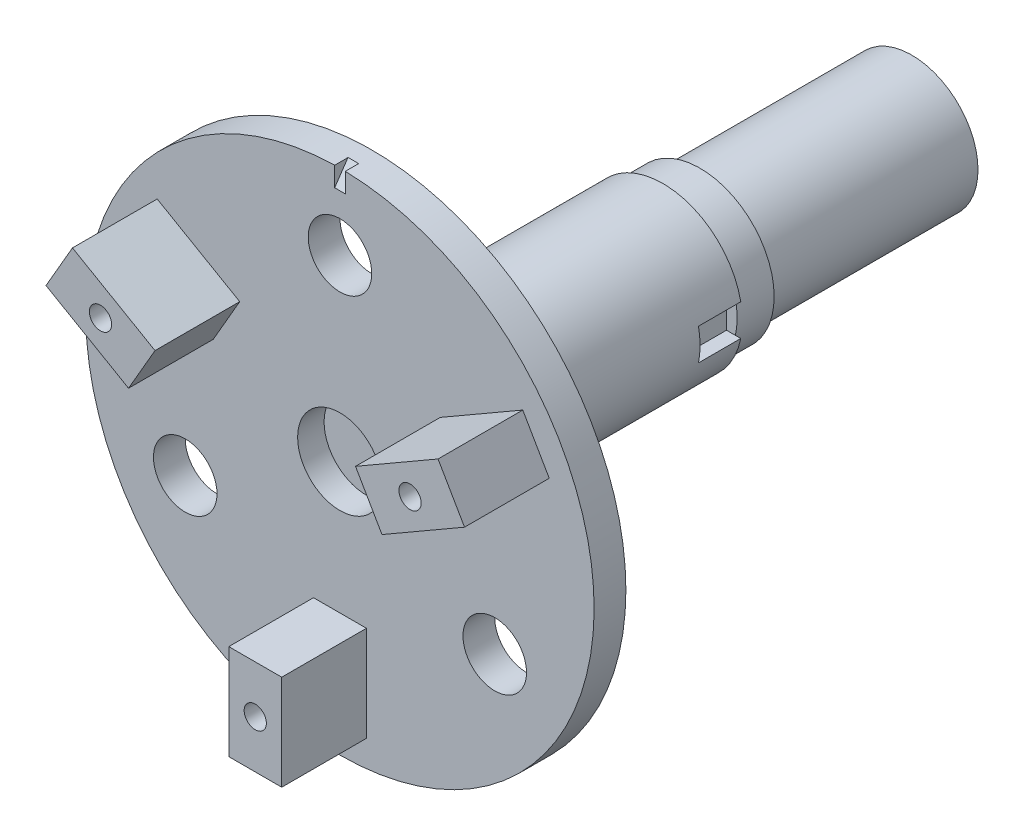
from build123d import *

# Parameters (mm, degrees)
SKETCH1_R                        = 48
SKETCH1_R_2                      = 8
EX_CARRIER_FRONT_PLATE_4MM_DEPTH = 3
SKETCH2_R                        = 6
CUT_PIN_HOLE_12_DEPTH            = 69.14690015
PAT_PIN_HOLES_3X120_COUNT        = 3
CUT_EXTRUDE1_DEPTH               = 1
SKETCH4_W                        = 10
SKETCH4_H                        = 18
BOSS_EXTRUDE1_DEPTH              = 19
SKETCH5_R                        = 2.1
CUT_EXTRUDE3_DEPTH               = 12
CIRPATTERN1_COUNT                = 3
CIRPATTERN2_COUNT                = 3
SKETCH7_W                        = 4.5
SKETCH7_H                        = 8
CUT_MB6_TAB_GROOVE_6W_M27_DEPTH  = 3


with BuildPart() as part:
    # Sketch1 → EX_Carrier_Front_Plate_4mm (new, symmetric)
    with BuildSketch(Plane.XY):
        Circle(SKETCH1_R)
        Circle(SKETCH1_R_2, mode=Mode.SUBTRACT)
    extrude(amount=EX_CARRIER_FRONT_PLATE_4MM_DEPTH, both=True)

    # Sketch2 → CUT_Pin_Hole_Ø12 (cut, symmetric)
    with BuildSketch(Plane.XY.offset(3)):
        with Locations((0, 33.75)):
            Circle(SKETCH2_R)
    cut_pin_hole_12 = extrude(amount=CUT_PIN_HOLE_12_DEPTH, both=True, mode=Mode.SUBTRACT)

    # PAT_Pin_Holes_3x120: CUT_Pin_Hole_Ø12 ×3 about axis
    pat_pin_holes_3x120_axis = Axis((0, 0, 3), (0, 0, 1))
    for i in range(1, PAT_PIN_HOLES_3X120_COUNT):
        add(cut_pin_hole_12.rotate(pat_pin_holes_3x120_axis, i * 360 / PAT_PIN_HOLES_3X120_COUNT), mode=Mode.SUBTRACT)

    # Sketch3 → Cut-Extrude1 (cut, symmetric)
    with BuildSketch(Plane(origin=(0, 0, 0), x_dir=(0, 0, -1), z_dir=(1, 0, 0))):
        Polygon((-0.476916813, 48), (-3, 44.300014389), (-3, 48), align=None)
    extrude(amount=CUT_EXTRUDE1_DEPTH, both=True, mode=Mode.SUBTRACT)

    # Sketch4 → Boss-Extrude1 (add)
    with BuildSketch(Plane.XY):
        with Locations((0, -33.75)):
            Rectangle(SKETCH4_W, SKETCH4_H)
    boss_extrude1 = extrude(amount=BOSS_EXTRUDE1_DEPTH)

    # Sketch5 → Cut-Extrude3 (cut)
    with BuildSketch(Plane.XY.offset(19)):
        with Locations((0, -33.75)):
            Circle(SKETCH5_R)
    cut_extrude3 = extrude(amount=-CUT_EXTRUDE3_DEPTH, mode=Mode.SUBTRACT)

    # CirPattern1: Boss-Extrude1 ×3 about axis
    cirpattern1_axis = Axis((0, 0, -3.308265016), (0, 0, 1))
    for i in range(1, CIRPATTERN1_COUNT):
        add(boss_extrude1.rotate(cirpattern1_axis, i * 360 / CIRPATTERN1_COUNT))

    # CirPattern2: Cut-Extrude3 ×3 about axis
    cirpattern2_axis = Axis((0, 0, -3.308265016), (0, 0, 1))
    for i in range(1, CIRPATTERN2_COUNT):
        add(cut_extrude3.rotate(cirpattern2_axis, i * 360 / CIRPATTERN2_COUNT), mode=Mode.SUBTRACT)

    # Sketch6 → Revolve1 (revolve)
    with BuildSketch(Plane(origin=(0, 0, 0), x_dir=(0, 0, -1), z_dir=(1, 0, 0))):
        Polygon((2, 0), (2, 18), (6, 18), (6, 15), (58, 15), (58, 14), (65, 14), (65, 12.5), (105, 12.5), (105, 0), align=None)
    revolve(axis=Axis((0, 0, 4), (0, 0, -1)))

    # Sketch7 → CUT_MB6_Tab_Groove_6w_M27 (cut, symmetric)
    with BuildSketch(Plane(origin=(0, 0, 0), x_dir=(1, 0, 0), z_dir=(0, 1, 0))):
        with Locations((14.25, 54)):
            Rectangle(SKETCH7_W, SKETCH7_H)
    extrude(amount=CUT_MB6_TAB_GROOVE_6W_M27_DEPTH, both=True, mode=Mode.SUBTRACT)


solid = part.part
